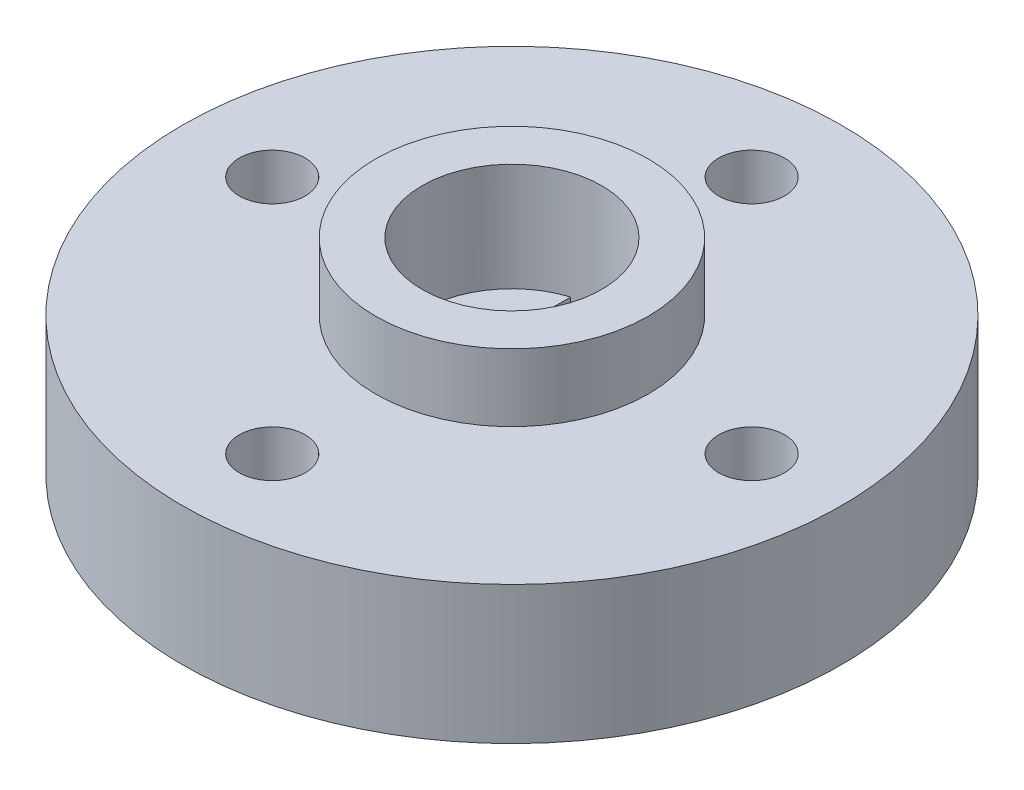
from build123d import *

# Parameters (mm, degrees)
CUT_EXTRUDE1_DEPTH      = 16.967466925
CUT_EXTRUDE1_DEPTH_BACK = 16.967466925
SKETCH5_R               = 1.1
CUT_EXTRUDE2_DEPTH      = 10


with BuildPart() as part:
    # Sketch3 → Revolve1 (revolve)
    with BuildSketch(Plane.XY, mode=Mode.PRIVATE) as revolve1_sk:
        Polygon((2.85, 0), (11, 0), (11, 4.6), (4.55, 4.6), (4.55, 6.85), (3, 6.85), (3, 3.25), (0, 3.25), (0, 1.6), (2.85, 1.6), align=None)
    revolve(revolve1_sk.sketch.rotate(Axis((0, 3.25, 0), (0, -1, 0)), 180), axis=Axis((0, 3.25, 0), (0, -1, 0)))

    # Sketch4 → Cut-Extrude1 (cut, two sides: drawn at the far end of the back side and taken through both)
    with BuildSketch(Plane(origin=(0, 3.25, 0), x_dir=(1, 0, 0), z_dir=(0, 1, 0)).offset(-CUT_EXTRUDE1_DEPTH_BACK)):
        with BuildLine():
            Line((-0.9, 2.861817604), (-0.9, 0.867467579))
            ThreePointArc((-0.9, 0.867467579), (0, -1.25), (0.9, 0.867467579))
            Line((0.9, 0.867467579), (0.9, 2.861817604))
            ThreePointArc((0.9, 2.861817604), (0, 3), (-0.9, 2.861817604))
        make_face()
    extrude(amount=CUT_EXTRUDE1_DEPTH + CUT_EXTRUDE1_DEPTH_BACK, mode=Mode.SUBTRACT)

    # Sketch5 → Cut-Extrude2 (cut)
    with BuildSketch(Plane.XZ):
        with Locations((0, 8)):
            Circle(SKETCH5_R)
        with Locations((8, 0)):
            Circle(SKETCH5_R)
        with Locations((0, -8)):
            Circle(SKETCH5_R)
        with Locations((-8, 0)):
            Circle(SKETCH5_R)
    extrude(amount=-CUT_EXTRUDE2_DEPTH, mode=Mode.SUBTRACT)


solid = part.part
